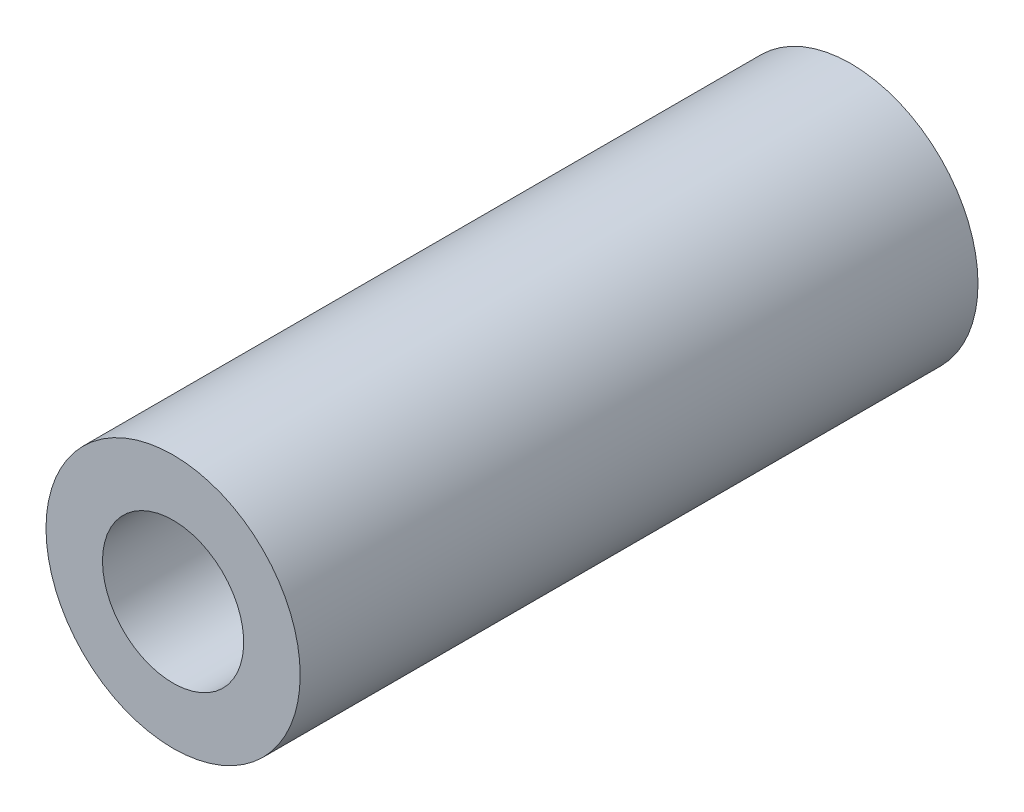
from build123d import *

# Parameters (mm, degrees)
SKETCH3_R           = 28.575
SKETCH3_R_2         = 15.875
BOSS_EXTRUDE1_DEPTH = 76.2


with BuildPart() as part:
    # Sketch3 → Boss-Extrude1 (new, symmetric)
    with BuildSketch(Plane.XY):
        with Locations(Location((0, 0, 0), (0, 0, 180))):
            Circle(SKETCH3_R)
        with Locations(Location((0, 0, 0), (0, 0, 180))):
            Circle(SKETCH3_R_2, mode=Mode.SUBTRACT)
    extrude(amount=BOSS_EXTRUDE1_DEPTH, both=True)


solid = part.part
